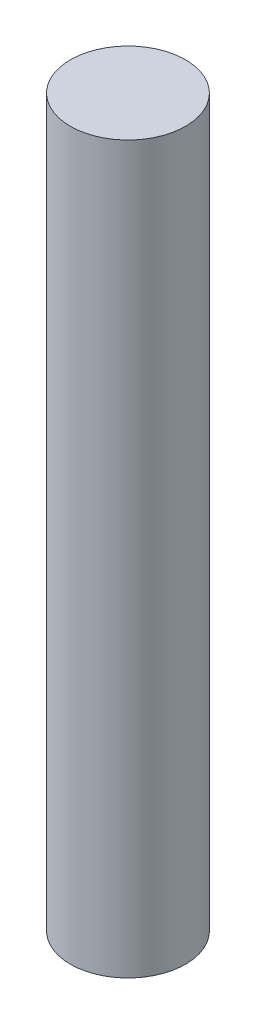
from build123d import *

# Parameters (mm, degrees)
SKETCH1_R           = 6.35
BOSS_EXTRUDE1_DEPTH = 80


with BuildPart() as part:
    # Sketch1 → Boss-Extrude1 (new body)
    with BuildSketch(Plane(origin=(0, 0, 0), x_dir=(1, 0, 0), z_dir=(0, 1, 0))):
        with Locations(Location((0, 0, 0), (0, 0, 270))):
            Circle(SKETCH1_R)
    extrude(amount=BOSS_EXTRUDE1_DEPTH)


solid = part.part
